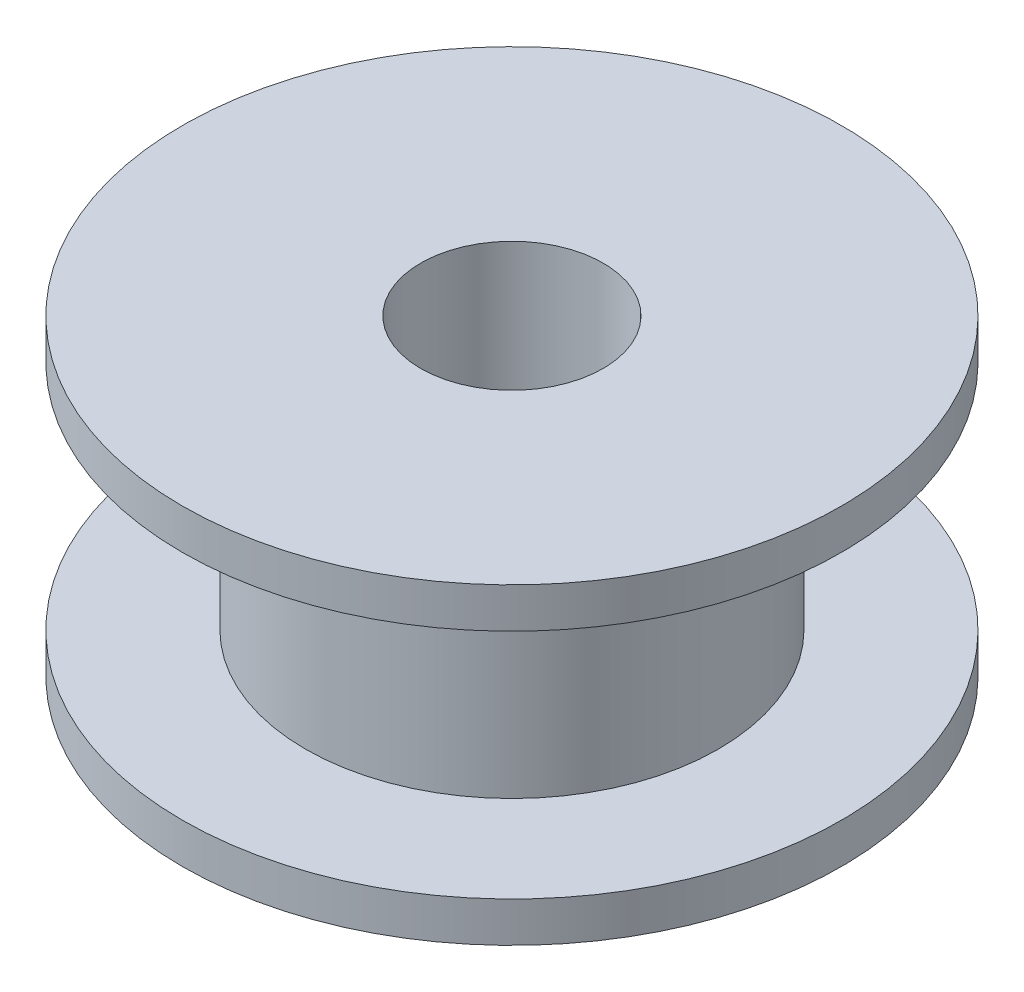
from build123d import *

# Parameters (mm, degrees)
SKETCH1_R           = 5.655
BOSS_EXTRUDE1_DEPTH = 6.35
SKETCH1_3_R         = 9.025
BOSS_EXTRUDE2_DEPTH = 1.1
BOSS_EXTRUDE3_START = 7.45
SKETCH1_4_R         = 9.025
BOSS_EXTRUDE3_DEPTH = 1.1
CUT_EXTRUDE1_REACH  = 17.362
SKETCH2_R           = 2.5


with BuildPart() as part:
    # Sketch1 → Boss-Extrude1 (new body)
    with BuildSketch(Plane(origin=(0, 0, 0), x_dir=(1, 0, 0), z_dir=(0, 1, 0))):
        Circle(SKETCH1_R)
    extrude(amount=BOSS_EXTRUDE1_DEPTH)

    # Sketch1<3> → Boss-Extrude2 (add)
    with BuildSketch(Plane(origin=(0, 0, 0), x_dir=(1, 0, 0), z_dir=(0, 1, 0))):
        Circle(SKETCH1_3_R)
    extrude(amount=-BOSS_EXTRUDE2_DEPTH)

    # Sketch1<4> → Boss-Extrude3 (add)
    with BuildSketch(Plane(origin=(0, 0, 0), x_dir=(1, 0, 0), z_dir=(0, 1, 0)).offset(BOSS_EXTRUDE3_START)):
        Circle(SKETCH1_4_R)
    extrude(amount=-BOSS_EXTRUDE3_DEPTH)

    # Sketch2 → Cut-Extrude1 (cut, up to next)
    with BuildSketch(Plane(origin=(0, 7.45, 0), x_dir=(1, 0, 0), z_dir=(0, 1, 0)), mode=Mode.PRIVATE) as cut_extrude1_sk1:
        Circle(SKETCH2_R)
    cut_extrude1_tool1 = extrude(cut_extrude1_sk1.sketch, amount=-CUT_EXTRUDE1_REACH, mode=Mode.PRIVATE) & part.part
    add(cut_extrude1_tool1.solids().sort_by_distance((0, 7.45, 0))[0], mode=Mode.SUBTRACT)


solid = part.part
